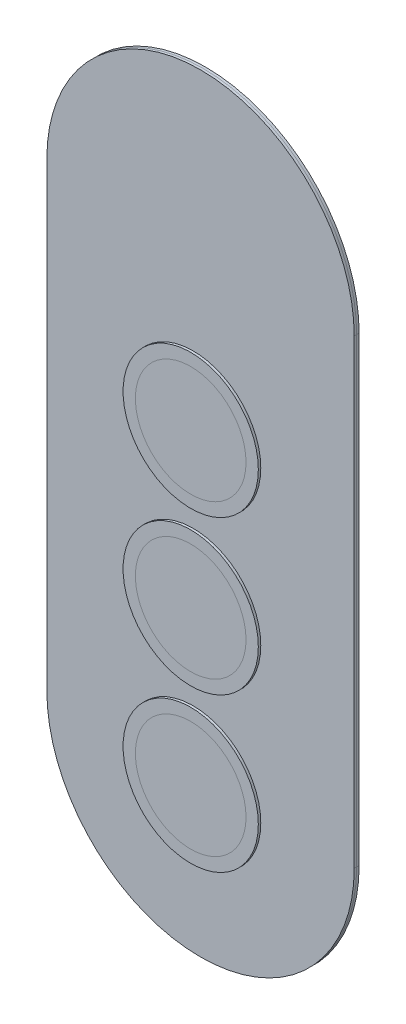
from build123d import *

# Parameters (mm, degrees)
SKETCH1_R             = 25
BOSS_EXTRUDE1_DEPTH   = 1
BOSS_EXTRUDE2_START   = 5
SKETCH4_R             = 27.5
SKETCH4_R_2           = 22.5
BOSS_EXTRUDE2_DEPTH   = 1
BOSS_EXTRUDE2_2_DEPTH = 1
BOSS_EXTRUDE2_3_DEPTH = 1
BOSS_EXTRUDE3_START   = 5
SKETCH5_R             = 22.5
BOSS_EXTRUDE3_DEPTH   = 1
BOSS_EXTRUDE3_2_DEPTH = 1
BOSS_EXTRUDE3_3_DEPTH = 1
BOSS_EXTRUDE4_DEPTH   = 1


with BuildPart() as part:
    # Sketch1 → Boss-Extrude1 (new body)
    with BuildSketch(Plane.XY):
        with BuildLine():
            Line((-62.5, -93.75), (-62.5, 93.75))
            ThreePointArc((-62.5, 93.75), (0, 156.25), (62.5, 93.75))
            Line((62.5, 93.75), (62.5, -93.75))
            ThreePointArc((62.5, -93.75), (0, -156.25), (-62.5, -93.75))
        make_face()
        with Locations((0, 31.25)):
            Circle(SKETCH1_R, mode=Mode.SUBTRACT)
        with Locations((0, -31.25)):
            Circle(SKETCH1_R, mode=Mode.SUBTRACT)
        with Locations((0, -93.75)):
            Circle(SKETCH1_R, mode=Mode.SUBTRACT)
    extrude(amount=BOSS_EXTRUDE1_DEPTH)


with BuildPart() as body_2:
    # Sketch4 → Boss-Extrude2 (new body)
    with BuildSketch(Plane.XY.offset(BOSS_EXTRUDE2_START)):
        with Locations((0, 31.25)):
            Circle(SKETCH4_R)
        with Locations((0, 31.25)):
            Circle(SKETCH4_R_2, mode=Mode.SUBTRACT)
    extrude(amount=BOSS_EXTRUDE2_DEPTH)


with BuildPart() as body_3:
    # Sketch4 → Boss-Extrude2 2 (new body)
    with BuildSketch(Plane.XY.offset(BOSS_EXTRUDE2_START)):
        with Locations((0, -31.25)):
            Circle(SKETCH4_R)
        with Locations((0, -31.25)):
            Circle(SKETCH4_R_2, mode=Mode.SUBTRACT)
    extrude(amount=BOSS_EXTRUDE2_2_DEPTH)


with BuildPart() as body_4:
    # Sketch4 → Boss-Extrude2 3 (new body)
    with BuildSketch(Plane.XY.offset(BOSS_EXTRUDE2_START)):
        with Locations((0, -93.75)):
            Circle(SKETCH4_R)
        with Locations((0, -93.75)):
            Circle(SKETCH4_R_2, mode=Mode.SUBTRACT)
    extrude(amount=BOSS_EXTRUDE2_3_DEPTH)


with BuildPart() as body_5:
    # Sketch5 → Boss-Extrude3 (new body)
    with BuildSketch(Plane.XY.offset(BOSS_EXTRUDE3_START)):
        with Locations((0, -93.75)):
            Circle(SKETCH5_R)
    extrude(amount=BOSS_EXTRUDE3_DEPTH)


with BuildPart() as body_6:
    # Sketch5 → Boss-Extrude3 2 (new body)
    with BuildSketch(Plane.XY.offset(BOSS_EXTRUDE3_START)):
        with Locations((0, -31.25)):
            Circle(SKETCH5_R)
    extrude(amount=BOSS_EXTRUDE3_2_DEPTH)


with BuildPart() as body_7:
    # Sketch5 → Boss-Extrude3 3 (new body)
    with BuildSketch(Plane.XY.offset(BOSS_EXTRUDE3_START)):
        with Locations((0, 31.25)):
            Circle(SKETCH5_R)
    extrude(amount=BOSS_EXTRUDE3_3_DEPTH)


with BuildPart() as body_8:
    # Sketch6 → Boss-Extrude4 (new body)
    with BuildSketch(Plane.XY.offset(1)):
        with BuildLine():
            Line((62.5, -93.75), (62.5, 93.75))
            ThreePointArc((62.5, 93.75), (0, 156.25), (-62.5, 93.75))
            Line((-62.5, 93.75), (-62.5, -93.75))
            ThreePointArc((-62.5, -93.75), (0, -156.25), (62.5, -93.75))
        make_face()
    extrude(amount=BOSS_EXTRUDE4_DEPTH)


solid = Compound([part.part, body_2.part, body_3.part, body_4.part, body_5.part, body_6.part, body_7.part, body_8.part])
